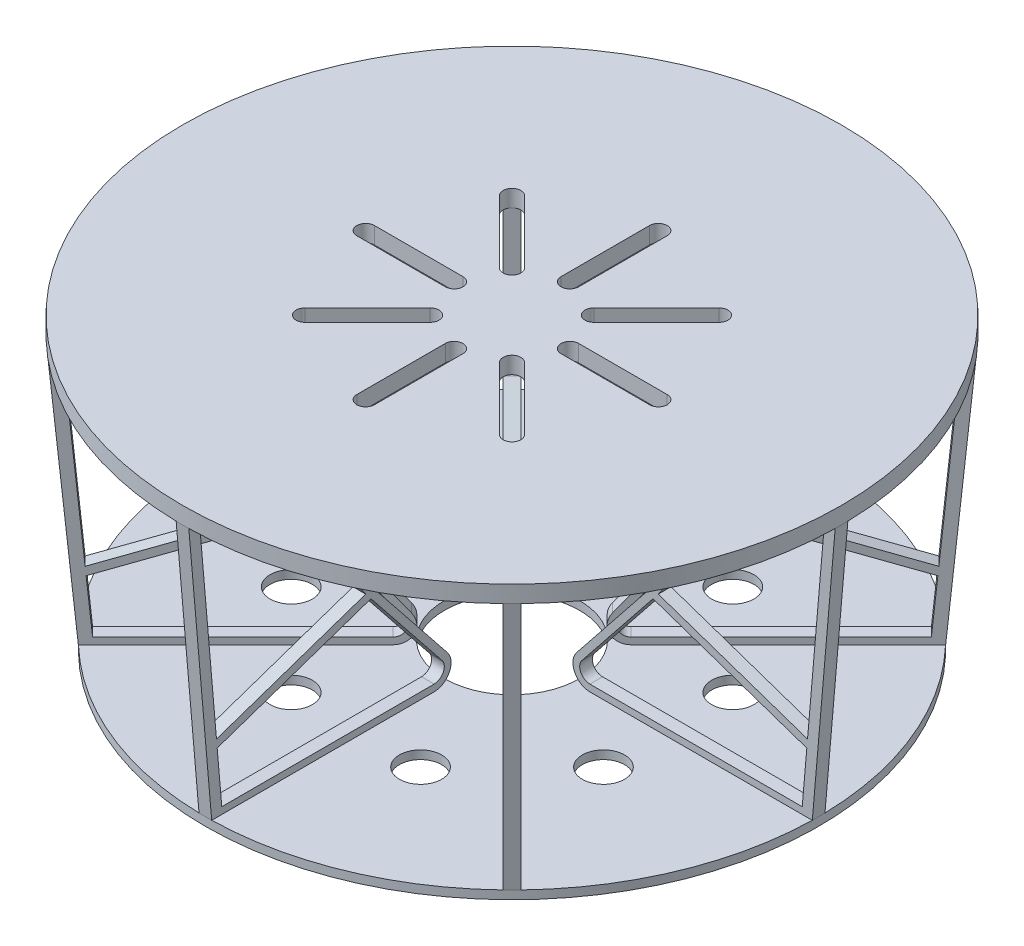
from build123d import *

# Parameters (mm, degrees)
SKETCH_1_R               = 362.93
SKETCH_1_R_2             = 80
EXTRUDE_1_DEPTH          = 10
SKETCH_2_R               = 390
EXTRUDE_2_DEPTH          = 20
SKETCH_3_R               = 25
CUT_EXTRUDE_1_DEPTH      = 10
CUT_EXTRUDE_2_DEPTH      = 20
EXTRUDE_3_DEPTH          = 7.5
PATTERN_CIRCULAR_1_COUNT = 8


with BuildPart() as part:
    # 草图1 → 凸台-拉伸1 (new body)
    with BuildSketch(Plane(origin=(0, 0, 0), x_dir=(1, 0, 0), z_dir=(0, 1, 0))):
        with Locations(Location((0, 0, 0), (0, 0, 270))):
            Circle(SKETCH_1_R)
        with Locations(Location((0, 0, 0), (0, 0, 270))):
            Circle(SKETCH_1_R_2, mode=Mode.SUBTRACT)
    extrude(amount=EXTRUDE_1_DEPTH)

    # 草图3 → 切除-拉伸1 (cut)
    with BuildSketch(Plane(origin=(0, 10, 0), x_dir=(1, 0, 0), z_dir=(0, 1, 0))):
        with Locations(Location((76.536686473, -184.775906502, 0), (0, 0, 270))):
            Circle(SKETCH_3_R)
        with Locations(Location((-76.536686473, -184.775906502, 0), (0, 0, 270))):
            Circle(SKETCH_3_R)
        with Locations(Location((-184.775906502, -76.536686473, 0), (0, 0, 270))):
            Circle(SKETCH_3_R)
        with Locations(Location((-184.775906502, 76.536686473, 0), (0, 0, 270))):
            Circle(SKETCH_3_R)
        with Locations(Location((-76.536686473, 184.775906502, 0), (0, 0, 270))):
            Circle(SKETCH_3_R)
        with Locations(Location((76.536686473, 184.775906502, 0), (0, 0, 270))):
            Circle(SKETCH_3_R)
        with Locations(Location((184.775906502, 76.536686473, 0), (0, 0, 270))):
            Circle(SKETCH_3_R)
        with Locations(Location((184.775906502, -76.536686473, 0), (0, 0, 270))):
            Circle(SKETCH_3_R)
    extrude(amount=-CUT_EXTRUDE_1_DEPTH, mode=Mode.SUBTRACT)



with BuildPart() as body_2:
    # 草图2 → 凸台-拉伸2 (new body)
    with BuildSketch(Plane(origin=(0, 322.6, 0), x_dir=(1, 0, 0), z_dir=(0, 1, 0))):
        with Locations(Location((0, 0, 0), (0, 0, 270))):
            Circle(SKETCH_2_R)
    extrude(amount=EXTRUDE_2_DEPTH)

    # 草图4 → 切除-拉伸2 (cut)
    with BuildSketch(Plane(origin=(0, 342.6, 0), x_dir=(1, 0, 0), z_dir=(0, 1, 0))):
        with BuildLine():
            Line((10.47, -68.51), (10.47, -173.27))
            ThreePointArc((10.47, -173.27), (0, -183.74), (-10.47, -173.27))
            Line((-10.47, -173.27), (-10.47, -68.51))
            ThreePointArc((-10.47, -68.51), (0, -58.04), (10.47, -68.51))
        make_face()
        with BuildLine():
            Line((-41.04047758, -55.847293578), (-115.116983977, -129.923799975))
            ThreePointArc((-115.116983977, -129.923799975), (-129.923799975, -129.923799975), (-129.923799975, -115.116983977))
            Line((-129.923799975, -115.116983977), (-55.847293578, -41.04047758))
            ThreePointArc((-55.847293578, -41.04047758), (-41.04047758, -41.04047758), (-41.04047758, -55.847293578))
        make_face()
        with BuildLine():
            Line((-68.51, -10.47), (-173.27, -10.47))
            ThreePointArc((-173.27, -10.47), (-183.74, 0), (-173.27, 10.47))
            Line((-173.27, 10.47), (-68.51, 10.47))
            ThreePointArc((-68.51, 10.47), (-58.04, 0), (-68.51, -10.47))
        make_face()
        with BuildLine():
            Line((-55.847293578, 41.04047758), (-129.923799975, 115.116983977))
            ThreePointArc((-129.923799975, 115.116983977), (-129.923799975, 129.923799975), (-115.116983977, 129.923799975))
            Line((-115.116983977, 129.923799975), (-41.04047758, 55.847293578))
            ThreePointArc((-41.04047758, 55.847293578), (-41.04047758, 41.04047758), (-55.847293578, 41.04047758))
        make_face()
        with BuildLine():
            Line((-10.47, 68.51), (-10.47, 173.27))
            ThreePointArc((-10.47, 173.27), (0, 183.74), (10.47, 173.27))
            Line((10.47, 173.27), (10.47, 68.51))
            ThreePointArc((10.47, 68.51), (0, 58.04), (-10.47, 68.51))
        make_face()
        with BuildLine():
            Line((41.04047758, 55.847293578), (115.116983977, 129.923799975))
            ThreePointArc((115.116983977, 129.923799975), (129.923799975, 129.923799975), (129.923799975, 115.116983977))
            Line((129.923799975, 115.116983977), (55.847293578, 41.04047758))
            ThreePointArc((55.847293578, 41.04047758), (41.04047758, 41.04047758), (41.04047758, 55.847293578))
        make_face()
        with BuildLine():
            Line((68.51, 10.47), (173.27, 10.47))
            ThreePointArc((173.27, 10.47), (183.74, 0), (173.27, -10.47))
            Line((173.27, -10.47), (68.51, -10.47))
            ThreePointArc((68.51, -10.47), (58.04, 0), (68.51, 10.47))
        make_face()
        with BuildLine():
            Line((55.847293578, -41.04047758), (129.923799975, -115.116983977))
            ThreePointArc((129.923799975, -115.116983977), (129.923799975, -129.923799975), (115.116983977, -129.923799975))
            Line((115.116983977, -129.923799975), (41.04047758, -55.847293578))
            ThreePointArc((41.04047758, -55.847293578), (41.04047758, -41.04047758), (55.847293578, -41.04047758))
        make_face()
    extrude(amount=-CUT_EXTRUDE_2_DEPTH, mode=Mode.SUBTRACT)


with BuildPart() as part_1:
    add(part.part)

    add(body_2.part)  # 凸台-拉伸3 merges body 2
    # 草图5 → 凸台-拉伸3 (add, symmetric)
    with BuildSketch(Plane(origin=(0, 0, 0), x_dir=(0, 0, -1), z_dir=(1, 0, 0))):
        with BuildLine():
            Line((-99.62072391, 10), (-362.93, 10))
            Line((-362.93, 10), (-390, 322.6))
            Line((-390, 322.6), (-377.372919908, 322.6))
            Line((-377.372919908, 322.6), (-357.271323299, 90.47))
            Line((-357.271323299, 90.47), (-180.662747803, 150.727517849))
            ThreePointArc((-180.662747803, 150.727517849), (-188.880631583, 165.090180046), (-191.732919908, 181.39))
            Line((-191.732919908, 181.39), (-191.732919908, 322.6))
            Line((-191.732919908, 322.6), (-183.732919908, 322.6))
            Line((-183.732919908, 322.6), (-183.732919908, 181.39))
            ThreePointArc((-183.732919908, 181.39), (-181.483804114, 168.166129855), (-174.989382827, 156.42936047))
            Line((-174.989382827, 156.42936047), (-83.99249245, 42.480319765))
            ThreePointArc((-83.99249245, 42.480319765), (-81.598426674, 21.328391017), (-99.62072391, 10))
        make_face()
        with BuildLine():
            Line((-350.995690221, 18), (-99.62072391, 18))
            ThreePointArc((-99.62072391, 18), (-88.807345568, 24.79703461), (-90.243785034, 37.488191859))
            Line((-90.243785034, 37.488191859), (-174.418457139, 142.894245827))
            Line((-174.418457139, 142.894245827), (-356.433258641, 80.79216432))
            Line((-356.433258641, 80.79216432), (-350.995690221, 18))
        make_face(mode=Mode.SUBTRACT)
    extrude_3 = extrude(amount=EXTRUDE_3_DEPTH, both=True)

    # 阵列(圆周)1: 凸台-拉伸3 ×8 about axis
    pattern_circular_1_axis = Axis((0, 0, 0), (0, 1, 0))
    for i in range(1, PATTERN_CIRCULAR_1_COUNT):
        add(extrude_3.rotate(pattern_circular_1_axis, i * 360 / PATTERN_CIRCULAR_1_COUNT))


solid = part_1.part
